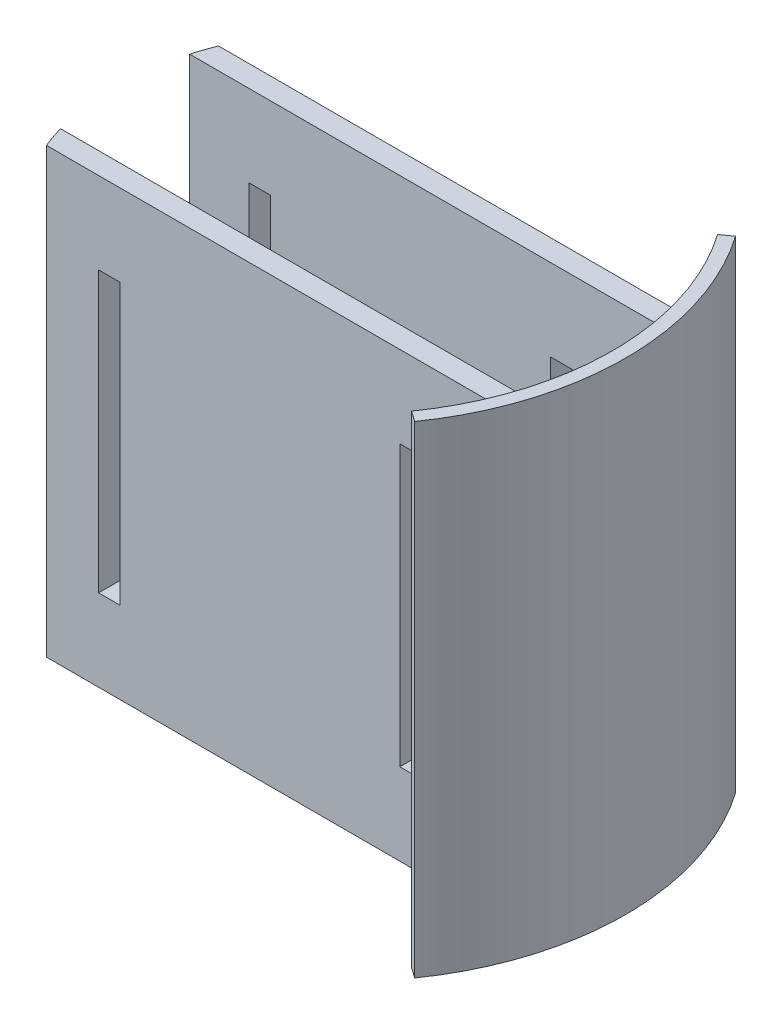
from build123d import *

# Parameters (mm, degrees)
BOSS_EXTRUDE1_DEPTH = 56
BOSS_EXTRUDE2_DEPTH = 51.5
CUT_EXTRUDE1_REACH  = 105.161
SKETCH3_W           = 5
SKETCH3_H           = 65


with BuildPart() as part:
    # Sketch1 → Boss-Extrude1 (new, symmetric)
    with BuildSketch(Plane(origin=(0, 0, 0), x_dir=(1, 0, 0), z_dir=(0, 1, 0))):
        with BuildLine():
            Line((50.787426746, 35.561739054), (53.244882879, 37.282468363))
            ThreePointArc((53.244882879, 37.282468363), (65, 0), (53.244882879, -37.282468363))
            Line((53.244882879, -37.282468363), (50.787426746, -35.561739054))
            ThreePointArc((50.787426746, -35.561739054), (62, 0), (50.787426746, 35.561739054))
        make_face()
    extrude(amount=BOSS_EXTRUDE1_DEPTH, both=True)

    # Sketch2 → Boss-Extrude2 (add, symmetric)
    with BuildSketch(Plane(origin=(0, 0, 0), x_dir=(1, 0, 0), z_dir=(0, 1, 0))):
        with BuildLine():
            Line((-51.354162441, 15), (60.158124971, 15))
            ThreePointArc((60.158124971, 15), (59.474430807, 17.515481159), (58.685603004, 20))
            Line((58.685603004, 20), (-49.621064076, 20))
            ThreePointArc((-49.621064076, 20), (-50.549471733, 17.521441364), (-51.354162441, 15))
        make_face()
        with BuildLine():
            Line((-49.621064076, -20), (58.685603004, -20))
            ThreePointArc((58.685603004, -20), (59.474430807, -17.515481159), (60.158124971, -15))
            Line((60.158124971, -15), (-51.354162441, -15))
            ThreePointArc((-51.354162441, -15), (-50.549471733, -17.521441364), (-49.621064076, -20))
        make_face()
    extrude(amount=BOSS_EXTRUDE2_DEPTH, both=True)

    # Cut-Extrude1: up to this face of the body (flat: up to its plane)
    cut_extrude1_end = Plane(part.part.faces().sort_by_distance((4.532269464, 0, -20))[0])
    # Sketch3 → Cut-Extrude1 (cut, up to the picked face)
    with BuildSketch(Plane.XY.offset(20), mode=Mode.PRIVATE) as cut_extrude1_sk1:
        with Locations((-35, 0)):
            Rectangle(SKETCH3_W, SKETCH3_H)
    cut_extrude1_tool1 = split(extrude(cut_extrude1_sk1.sketch, amount=-CUT_EXTRUDE1_REACH, mode=Mode.PRIVATE), bisect_by=cut_extrude1_end, keep=Keep.BOTH, mode=Mode.PRIVATE)
    # Sketch3 → Cut-Extrude1 (cut, up to the picked face)
    with BuildSketch(Plane.XY.offset(20), mode=Mode.PRIVATE) as cut_extrude1_sk2:
        with Locations((35, 0)):
            Rectangle(SKETCH3_W, SKETCH3_H)
    cut_extrude1_tool2 = split(extrude(cut_extrude1_sk2.sketch, amount=-CUT_EXTRUDE1_REACH, mode=Mode.PRIVATE), bisect_by=cut_extrude1_end, keep=Keep.BOTH, mode=Mode.PRIVATE)
    add(cut_extrude1_tool1.solids().sort_by(Axis((-35, 0, 20), (0, 0, -1)))[0], mode=Mode.SUBTRACT)
    add(cut_extrude1_tool2.solids().sort_by(Axis((35, 0, 20), (0, 0, -1)))[0], mode=Mode.SUBTRACT)


solid = part.part
